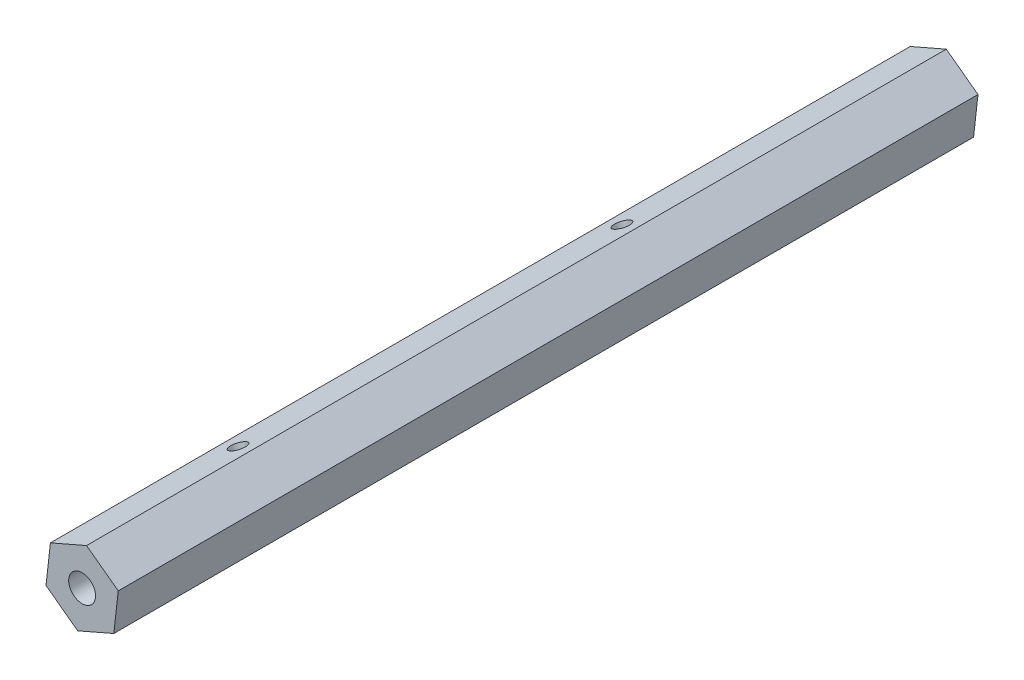
from build123d import *

# Parameters (mm, degrees)
ESBO_O1_R                = 2.5
RESSALTO_EXTRUS_O1_DEPTH = 160
ESBO_O2_R                = 1.5
CORTE_EXTRUS_O1_DEPTH    = 161.802731845
ESBO_O3_R                = 1.5
CORTE_EXTRUS_O2_DEPTH    = 161.802731945


with BuildPart() as part:
    # Esboço1 → Ressalto-extrusão1 (new body)
    with BuildSketch(Plane.XY):
        Polygon((5.897209639, -4.357321633), (6.722156046, 2.928472542), (0.824946407, 7.285794175), (-5.897209639, 4.357321633), (-6.722156046, -2.928472542), (-0.824946407, -7.285794175), align=None)
        Circle(ESBO_O1_R, mode=Mode.SUBTRACT)
    extrude(amount=RESSALTO_EXTRUS_O1_DEPTH)

    # Esboço2 → Corte-extrusão1 (cut, through all)
    with BuildSketch(Plane(origin=(-2.536131616, 5.821557904, 0), x_dir=(0.9167807722613587, 0.39939080561758905, 0), z_dir=(-0.3993908056175891, 0.9167807722613588, 0))):
        with Locations(Location((0, -57, 0), (0, 0, 180))):
            Circle(ESBO_O2_R)
    extrude(amount=-CORTE_EXTRUS_O1_DEPTH, mode=Mode.SUBTRACT)

    # Esboço3 → Corte-extrusão2 (cut, through all)
    with BuildSketch(Plane(origin=(-2.536131616, 5.821557904, 0), x_dir=(0.9167807722613587, 0.39939080561758905, 0), z_dir=(-0.3993908056175891, 0.9167807722613588, 0))):
        with Locations(Location((0, -128.44, 0), (0, 0, 180))):
            Circle(ESBO_O3_R)
    extrude(amount=-CORTE_EXTRUS_O2_DEPTH, mode=Mode.SUBTRACT)


solid = part.part
